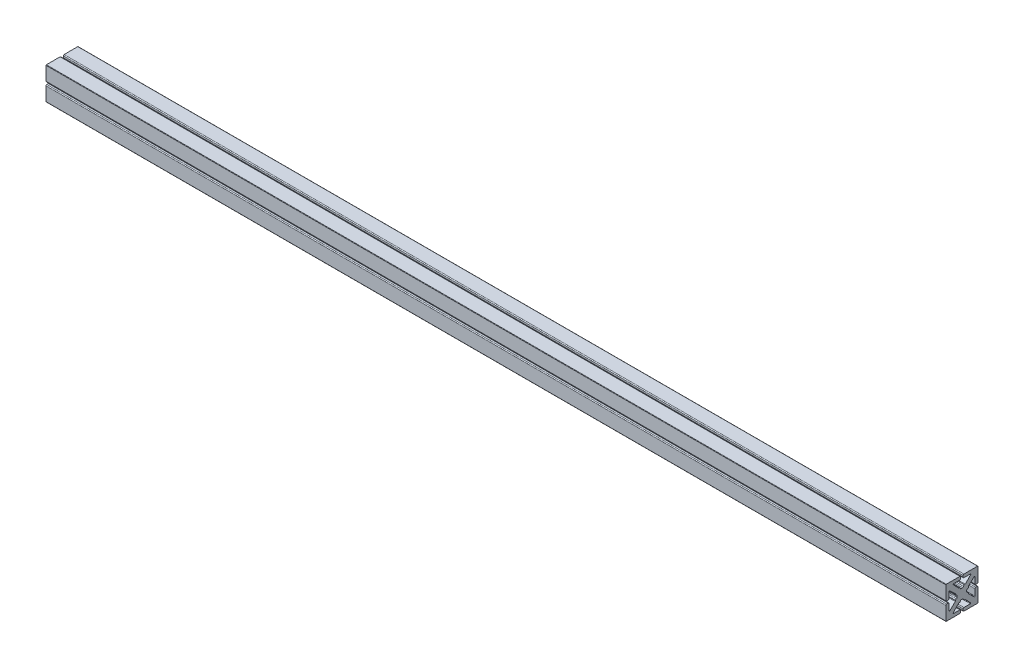
from build123d import *

# Parameters (mm, degrees)
BOSS_EXTRUDE1_DEPTH = 2.54
SCALE1_SCALE        = 8
BOSS_EXTRUDE2_DEPTH = 1120


with BuildPart() as part:
    # Sketch1 → Boss-Extrude1 (new body)
    with BuildSketch(Plane(origin=(0, 0, 0), x_dir=(0, 0, -1), z_dir=(1, 0, 0))):
        with BuildLine():
            Line((-0.2413, 1.4986), (0.2413, 1.4986))
            ThreePointArc((0.2413, 1.4986), (0.420905122, 1.572994878), (0.4953, 1.7526))
            ThreePointArc((0.4953, 1.7526), (0.569694878, 1.932205122), (0.7493, 2.0066))
            Line((0.7493, 2.0066), (0.882498635, 2.0066))
            ThreePointArc((0.882498635, 2.0066), (0.981966313, 2.026886113), (1.065545703, 2.084504086))
            Line((1.065545703, 2.084504086), (2.714118421, 3.798152043))
            ThreePointArc((2.714118421, 3.798152043), (2.739451831, 3.935933839), (2.622594887, 4.0132))
            Line((2.622594887, 4.0132), (0.635, 4.0132))
            ThreePointArc((0.635, 4.0132), (0.455394878, 4.087594878), (0.381, 4.2672))
            Line((0.381, 4.2672), (0.381, 4.7498))
            ThreePointArc((0.381, 4.7498), (0.455394878, 4.929405122), (0.635, 5.0038))
            Line((0.635, 5.0038), (4.8768, 5.0038))
            ThreePointArc((4.8768, 5.0038), (4.966602561, 4.966602561), (5.0038, 4.8768))
            Line((5.0038, 4.8768), (5.0038, 0.635))
            ThreePointArc((5.0038, 0.635), (4.929405122, 0.455394878), (4.7498, 0.381))
            Line((4.7498, 0.381), (4.2672, 0.381))
            ThreePointArc((4.2672, 0.381), (4.087594878, 0.455394878), (4.0132, 0.635))
            Line((4.0132, 0.635), (4.0132, 2.622594887))
            ThreePointArc((4.0132, 2.622594887), (3.935933839, 2.739451831), (3.798152043, 2.714118421))
            Line((3.798152043, 2.714118421), (2.084504086, 1.065545703))
            ThreePointArc((2.084504086, 1.065545703), (2.026886113, 0.981966313), (2.0066, 0.882498635))
            Line((2.0066, 0.882498635), (2.0066, 0.7493))
            ThreePointArc((2.0066, 0.7493), (1.932205122, 0.569694878), (1.7526, 0.4953))
            ThreePointArc((1.7526, 0.4953), (1.572994878, 0.420905122), (1.4986, 0.2413))
            Line((1.4986, 0.2413), (1.4986, -0.2413))
            ThreePointArc((1.4986, -0.2413), (1.572994878, -0.420905122), (1.7526, -0.4953))
            ThreePointArc((1.7526, -0.4953), (1.932205122, -0.569694878), (2.0066, -0.7493))
            Line((2.0066, -0.7493), (2.0066, -0.882498635))
            ThreePointArc((2.0066, -0.882498635), (2.026886113, -0.981966313), (2.084504086, -1.065545703))
            Line((2.084504086, -1.065545703), (3.798152043, -2.714118421))
            ThreePointArc((3.798152043, -2.714118421), (3.935933839, -2.739451831), (4.0132, -2.622594887))
            Line((4.0132, -2.622594887), (4.0132, -0.635))
            ThreePointArc((4.0132, -0.635), (4.087594878, -0.455394878), (4.2672, -0.381))
            Line((4.2672, -0.381), (4.7498, -0.381))
            ThreePointArc((4.7498, -0.381), (4.929405122, -0.455394878), (5.0038, -0.635))
            Line((5.0038, -0.635), (5.0038, -4.8768))
            ThreePointArc((5.0038, -4.8768), (4.966602561, -4.966602561), (4.8768, -5.0038))
            Line((4.8768, -5.0038), (0.635, -5.0038))
            ThreePointArc((0.635, -5.0038), (0.455394878, -4.929405122), (0.381, -4.7498))
            Line((0.381, -4.7498), (0.381, -4.2672))
            ThreePointArc((0.381, -4.2672), (0.455394878, -4.087594878), (0.635, -4.0132))
            Line((0.635, -4.0132), (2.622594887, -4.0132))
            ThreePointArc((2.622594887, -4.0132), (2.739451831, -3.935933839), (2.714118421, -3.798152043))
            Line((2.714118421, -3.798152043), (1.065545703, -2.084504086))
            ThreePointArc((1.065545703, -2.084504086), (0.981966313, -2.026886113), (0.882498635, -2.0066))
            Line((0.882498635, -2.0066), (0.7493, -2.0066))
            ThreePointArc((0.7493, -2.0066), (0.569694878, -1.932205122), (0.4953, -1.7526))
            ThreePointArc((0.4953, -1.7526), (0.420905122, -1.572994878), (0.2413, -1.4986))
            Line((0.2413, -1.4986), (-0.2413, -1.4986))
            ThreePointArc((-0.2413, -1.4986), (-0.420905122, -1.572994878), (-0.4953, -1.7526))
            ThreePointArc((-0.4953, -1.7526), (-0.569694878, -1.932205122), (-0.7493, -2.0066))
            Line((-0.7493, -2.0066), (-0.882498635, -2.0066))
            ThreePointArc((-0.882498635, -2.0066), (-0.981966313, -2.026886113), (-1.065545703, -2.084504086))
            Line((-1.065545703, -2.084504086), (-2.714118421, -3.798152043))
            ThreePointArc((-2.714118421, -3.798152043), (-2.739451831, -3.935933839), (-2.622594887, -4.0132))
            Line((-2.622594887, -4.0132), (-0.635, -4.0132))
            ThreePointArc((-0.635, -4.0132), (-0.455394878, -4.087594878), (-0.381, -4.2672))
            Line((-0.381, -4.2672), (-0.381, -4.7498))
            ThreePointArc((-0.381, -4.7498), (-0.455394878, -4.929405122), (-0.635, -5.0038))
            Line((-0.635, -5.0038), (-4.8768, -5.0038))
            ThreePointArc((-4.8768, -5.0038), (-4.966602561, -4.966602561), (-5.0038, -4.8768))
            Line((-5.0038, -4.8768), (-5.0038, -0.635))
            ThreePointArc((-5.0038, -0.635), (-4.929405122, -0.455394878), (-4.7498, -0.381))
            Line((-4.7498, -0.381), (-4.2672, -0.381))
            ThreePointArc((-4.2672, -0.381), (-4.087594878, -0.455394878), (-4.0132, -0.635))
            Line((-4.0132, -0.635), (-4.0132, -2.622594887))
            ThreePointArc((-4.0132, -2.622594887), (-3.935933839, -2.739451831), (-3.798152043, -2.714118421))
            Line((-3.798152043, -2.714118421), (-2.084504086, -1.065545703))
            ThreePointArc((-2.084504086, -1.065545703), (-2.026886113, -0.981966313), (-2.0066, -0.882498635))
            Line((-2.0066, -0.882498635), (-2.0066, -0.7493))
            ThreePointArc((-2.0066, -0.7493), (-1.932205122, -0.569694878), (-1.7526, -0.4953))
            ThreePointArc((-1.7526, -0.4953), (-1.572994878, -0.420905122), (-1.4986, -0.2413))
            Line((-1.4986, -0.2413), (-1.4986, 0.2413))
            ThreePointArc((-1.4986, 0.2413), (-1.572994878, 0.420905122), (-1.7526, 0.4953))
            ThreePointArc((-1.7526, 0.4953), (-1.932205122, 0.569694878), (-2.0066, 0.7493))
            Line((-2.0066, 0.7493), (-2.0066, 0.882498635))
            ThreePointArc((-2.0066, 0.882498635), (-2.026886113, 0.981966313), (-2.084504086, 1.065545703))
            Line((-2.084504086, 1.065545703), (-3.798152043, 2.714118421))
            ThreePointArc((-3.798152043, 2.714118421), (-3.935933839, 2.739451831), (-4.0132, 2.622594887))
            Line((-4.0132, 2.622594887), (-4.0132, 0.635))
            ThreePointArc((-4.0132, 0.635), (-4.087594878, 0.455394878), (-4.2672, 0.381))
            Line((-4.2672, 0.381), (-4.7498, 0.381))
            ThreePointArc((-4.7498, 0.381), (-4.929405122, 0.455394878), (-5.0038, 0.635))
            Line((-5.0038, 0.635), (-5.0038, 4.8768))
            ThreePointArc((-5.0038, 4.8768), (-4.966602561, 4.966602561), (-4.8768, 5.0038))
            Line((-4.8768, 5.0038), (-0.635, 5.0038))
            ThreePointArc((-0.635, 5.0038), (-0.455394878, 4.929405122), (-0.381, 4.7498))
            Line((-0.381, 4.7498), (-0.381, 4.2672))
            ThreePointArc((-0.381, 4.2672), (-0.455394878, 4.087594878), (-0.635, 4.0132))
            Line((-0.635, 4.0132), (-2.622594887, 4.0132))
            ThreePointArc((-2.622594887, 4.0132), (-2.739451831, 3.935933839), (-2.714118421, 3.798152043))
            Line((-2.714118421, 3.798152043), (-1.065545703, 2.084504086))
            ThreePointArc((-1.065545703, 2.084504086), (-0.981966313, 2.026886113), (-0.882498635, 2.0066))
            Line((-0.882498635, 2.0066), (-0.7493, 2.0066))
            ThreePointArc((-0.7493, 2.0066), (-0.569694878, 1.932205122), (-0.4953, 1.7526))
            ThreePointArc((-0.4953, 1.7526), (-0.420905122, 1.572994878), (-0.2413, 1.4986))
        make_face()
    extrude(amount=BOSS_EXTRUDE1_DEPTH)


with BuildPart() as part_1:
    # Scale1: scaled about (1.27, 0, 0)
    add(part.part.scale(SCALE1_SCALE).moved(Location((-8.89, 0, 0))))

    # Sketch2 → Boss-Extrude2 (add, symmetric)
    with BuildSketch(Plane(origin=(0, 0, 0), x_dir=(0, 0, -1), z_dir=(1, 0, 0))):
        with BuildLine():
            Line((-37.9984, 3.048), (-34.1376, 3.048))
            ThreePointArc((-34.1376, 3.048), (-32.700759021, 3.643159021), (-32.1056, 5.08))
            Line((-32.1056, 5.08), (-32.1056, 20.980759097))
            ThreePointArc((-32.1056, 20.980759097), (-31.487470712, 21.915614646), (-30.385216345, 21.71294737))
            Line((-30.385216345, 21.71294737), (-16.67603269, 8.524365626))
            ThreePointArc((-16.67603269, 8.524365626), (-16.215088903, 7.855730504), (-16.0528, 7.059989081))
            Line((-16.0528, 7.059989081), (-16.0528, 5.9944))
            ThreePointArc((-16.0528, 5.9944), (-15.457640979, 4.557559021), (-14.0208, 3.9624))
            ThreePointArc((-14.0208, 3.9624), (-12.583959021, 3.367240979), (-11.9888, 1.9304))
            Line((-11.9888, 1.9304), (-11.9888, -1.9304))
            ThreePointArc((-11.9888, -1.9304), (-12.583959021, -3.367240979), (-14.0208, -3.9624))
            ThreePointArc((-14.0208, -3.9624), (-15.457640979, -4.557559021), (-16.0528, -5.9944))
            Line((-16.0528, -5.9944), (-16.0528, -7.059989081))
            ThreePointArc((-16.0528, -7.059989081), (-16.215088903, -7.855730504), (-16.67603269, -8.524365626))
            Line((-16.67603269, -8.524365626), (-30.385216345, -21.71294737))
            ThreePointArc((-30.385216345, -21.71294737), (-31.487470712, -21.915614646), (-32.1056, -20.980759097))
            Line((-32.1056, -20.980759097), (-32.1056, -5.08))
            ThreePointArc((-32.1056, -5.08), (-32.700759021, -3.643159021), (-34.1376, -3.048))
            Line((-34.1376, -3.048), (-37.9984, -3.048))
            ThreePointArc((-37.9984, -3.048), (-39.435240979, -3.643159021), (-40.0304, -5.08))
            Line((-40.0304, -5.08), (-40.0304, -39.0144))
            ThreePointArc((-40.0304, -39.0144), (-39.73282049, -39.73282049), (-39.0144, -40.0304))
            Line((-39.0144, -40.0304), (-5.08, -40.0304))
            ThreePointArc((-5.08, -40.0304), (-3.643159021, -39.435240979), (-3.048, -37.9984))
            Line((-3.048, -37.9984), (-3.048, -34.1376))
            ThreePointArc((-3.048, -34.1376), (-3.643159021, -32.700759021), (-5.08, -32.1056))
            Line((-5.08, -32.1056), (-20.980759097, -32.1056))
            ThreePointArc((-20.980759097, -32.1056), (-21.915614646, -31.487470712), (-21.71294737, -30.385216345))
            Line((-21.71294737, -30.385216345), (-8.524365626, -16.67603269))
            ThreePointArc((-8.524365626, -16.67603269), (-7.855730504, -16.215088903), (-7.059989081, -16.0528))
            Line((-7.059989081, -16.0528), (-5.9944, -16.0528))
            ThreePointArc((-5.9944, -16.0528), (-4.557559021, -15.457640979), (-3.9624, -14.0208))
            ThreePointArc((-3.9624, -14.0208), (-3.367240979, -12.583959021), (-1.9304, -11.9888))
            Line((-1.9304, -11.9888), (1.9304, -11.9888))
            ThreePointArc((1.9304, -11.9888), (3.367240979, -12.583959021), (3.9624, -14.0208))
            ThreePointArc((3.9624, -14.0208), (4.557559021, -15.457640979), (5.9944, -16.0528))
            Line((5.9944, -16.0528), (7.059989081, -16.0528))
            ThreePointArc((7.059989081, -16.0528), (7.855730504, -16.215088903), (8.524365626, -16.67603269))
            Line((8.524365626, -16.67603269), (21.71294737, -30.385216345))
            ThreePointArc((21.71294737, -30.385216345), (21.915614646, -31.487470712), (20.980759097, -32.1056))
            Line((20.980759097, -32.1056), (5.08, -32.1056))
            ThreePointArc((5.08, -32.1056), (3.643159021, -32.700759021), (3.048, -34.1376))
            Line((3.048, -34.1376), (3.048, -37.9984))
            ThreePointArc((3.048, -37.9984), (3.643159021, -39.435240979), (5.08, -40.0304))
            Line((5.08, -40.0304), (39.0144, -40.0304))
            ThreePointArc((39.0144, -40.0304), (39.73282049, -39.73282049), (40.0304, -39.0144))
            Line((40.0304, -39.0144), (40.0304, -5.08))
            ThreePointArc((40.0304, -5.08), (39.435240979, -3.643159021), (37.9984, -3.048))
            Line((37.9984, -3.048), (34.1376, -3.048))
            ThreePointArc((34.1376, -3.048), (32.700759021, -3.643159021), (32.1056, -5.08))
            Line((32.1056, -5.08), (32.1056, -20.980759097))
            ThreePointArc((32.1056, -20.980759097), (31.487470712, -21.915614646), (30.385216345, -21.71294737))
            Line((30.385216345, -21.71294737), (16.67603269, -8.524365626))
            ThreePointArc((16.67603269, -8.524365626), (16.215088903, -7.855730504), (16.0528, -7.059989081))
            Line((16.0528, -7.059989081), (16.0528, -5.9944))
            ThreePointArc((16.0528, -5.9944), (15.457640979, -4.557559021), (14.0208, -3.9624))
            ThreePointArc((14.0208, -3.9624), (12.583959021, -3.367240979), (11.9888, -1.9304))
            Line((11.9888, -1.9304), (11.9888, 1.9304))
            ThreePointArc((11.9888, 1.9304), (12.583959021, 3.367240979), (14.0208, 3.9624))
            ThreePointArc((14.0208, 3.9624), (15.457640979, 4.557559021), (16.0528, 5.9944))
            Line((16.0528, 5.9944), (16.0528, 7.059989081))
            ThreePointArc((16.0528, 7.059989081), (16.215088903, 7.855730504), (16.67603269, 8.524365626))
            Line((16.67603269, 8.524365626), (30.385216345, 21.71294737))
            ThreePointArc((30.385216345, 21.71294737), (31.487470712, 21.915614646), (32.1056, 20.980759097))
            Line((32.1056, 20.980759097), (32.1056, 5.08))
            ThreePointArc((32.1056, 5.08), (32.700759021, 3.643159021), (34.1376, 3.048))
            Line((34.1376, 3.048), (37.9984, 3.048))
            ThreePointArc((37.9984, 3.048), (39.435240979, 3.643159021), (40.0304, 5.08))
            Line((40.0304, 5.08), (40.0304, 39.0144))
            ThreePointArc((40.0304, 39.0144), (39.73282049, 39.73282049), (39.0144, 40.0304))
            Line((39.0144, 40.0304), (5.08, 40.0304))
            ThreePointArc((5.08, 40.0304), (3.643159021, 39.435240979), (3.048, 37.9984))
            Line((3.048, 37.9984), (3.048, 34.1376))
            ThreePointArc((3.048, 34.1376), (3.643159021, 32.700759021), (5.08, 32.1056))
            Line((5.08, 32.1056), (20.980759097, 32.1056))
            ThreePointArc((20.980759097, 32.1056), (21.915614646, 31.487470712), (21.71294737, 30.385216345))
            Line((21.71294737, 30.385216345), (8.524365626, 16.67603269))
            ThreePointArc((8.524365626, 16.67603269), (7.855730504, 16.215088903), (7.059989081, 16.0528))
            Line((7.059989081, 16.0528), (5.9944, 16.0528))
            ThreePointArc((5.9944, 16.0528), (4.557559021, 15.457640979), (3.9624, 14.0208))
            ThreePointArc((3.9624, 14.0208), (3.367240979, 12.583959021), (1.9304, 11.9888))
            Line((1.9304, 11.9888), (-1.9304, 11.9888))
            ThreePointArc((-1.9304, 11.9888), (-3.367240979, 12.583959021), (-3.9624, 14.0208))
            ThreePointArc((-3.9624, 14.0208), (-4.557559021, 15.457640979), (-5.9944, 16.0528))
            Line((-5.9944, 16.0528), (-7.059989081, 16.0528))
            ThreePointArc((-7.059989081, 16.0528), (-7.855730504, 16.215088903), (-8.524365626, 16.67603269))
            Line((-8.524365626, 16.67603269), (-21.71294737, 30.385216345))
            ThreePointArc((-21.71294737, 30.385216345), (-21.915614646, 31.487470712), (-20.980759097, 32.1056))
            Line((-20.980759097, 32.1056), (-5.08, 32.1056))
            ThreePointArc((-5.08, 32.1056), (-3.643159021, 32.700759021), (-3.048, 34.1376))
            Line((-3.048, 34.1376), (-3.048, 37.9984))
            ThreePointArc((-3.048, 37.9984), (-3.643159021, 39.435240979), (-5.08, 40.0304))
            Line((-5.08, 40.0304), (-39.0144, 40.0304))
            ThreePointArc((-39.0144, 40.0304), (-39.73282049, 39.73282049), (-40.0304, 39.0144))
            Line((-40.0304, 39.0144), (-40.0304, 5.08))
            ThreePointArc((-40.0304, 5.08), (-39.435240979, 3.643159021), (-37.9984, 3.048))
        make_face()
    extrude(amount=BOSS_EXTRUDE2_DEPTH, both=True)


solid = part_1.part
